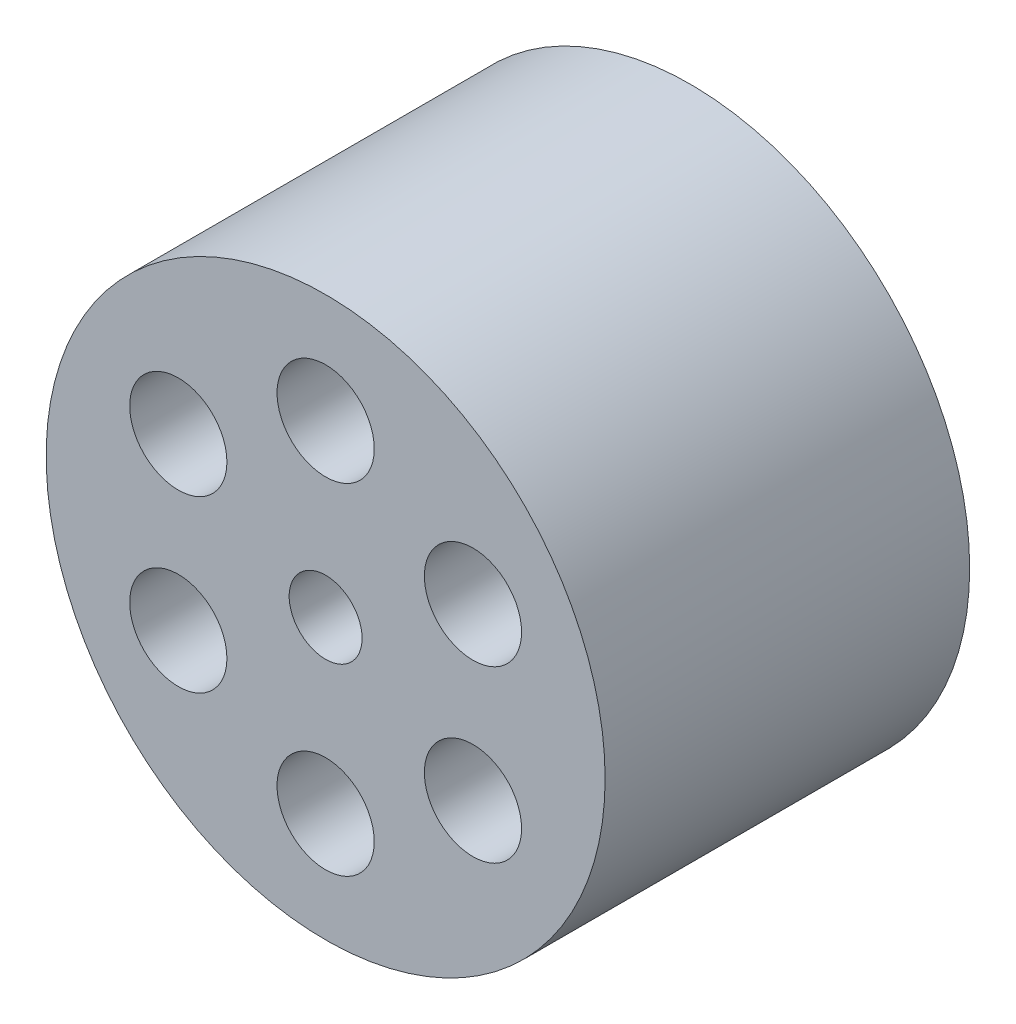
from build123d import *

# Parameters (mm, degrees)
ESQUISSE1_R        = 23
ESQUISSE1_R_2      = 3
ESQUISSE1_R_3      = 4
BOSS_EXTRU_1_DEPTH = 30


with BuildPart() as part:
    # Esquisse1 → Boss.-Extru.1 (new body)
    with BuildSketch(Plane.XY):
        Circle(ESQUISSE1_R)
        Circle(ESQUISSE1_R_2, mode=Mode.SUBTRACT)
        with Locations((0, 14)):
            Circle(ESQUISSE1_R_3, mode=Mode.SUBTRACT)
        with Locations((12.124355653, 7)):
            Circle(ESQUISSE1_R_3, mode=Mode.SUBTRACT)
        with Locations((12.124355653, -7)):
            Circle(ESQUISSE1_R_3, mode=Mode.SUBTRACT)
        with Locations((0, -14)):
            Circle(ESQUISSE1_R_3, mode=Mode.SUBTRACT)
        with Locations((-12.124355653, -7)):
            Circle(ESQUISSE1_R_3, mode=Mode.SUBTRACT)
        with Locations((-12.124355653, 7)):
            Circle(ESQUISSE1_R_3, mode=Mode.SUBTRACT)
    extrude(amount=BOSS_EXTRU_1_DEPTH)


solid = part.part
